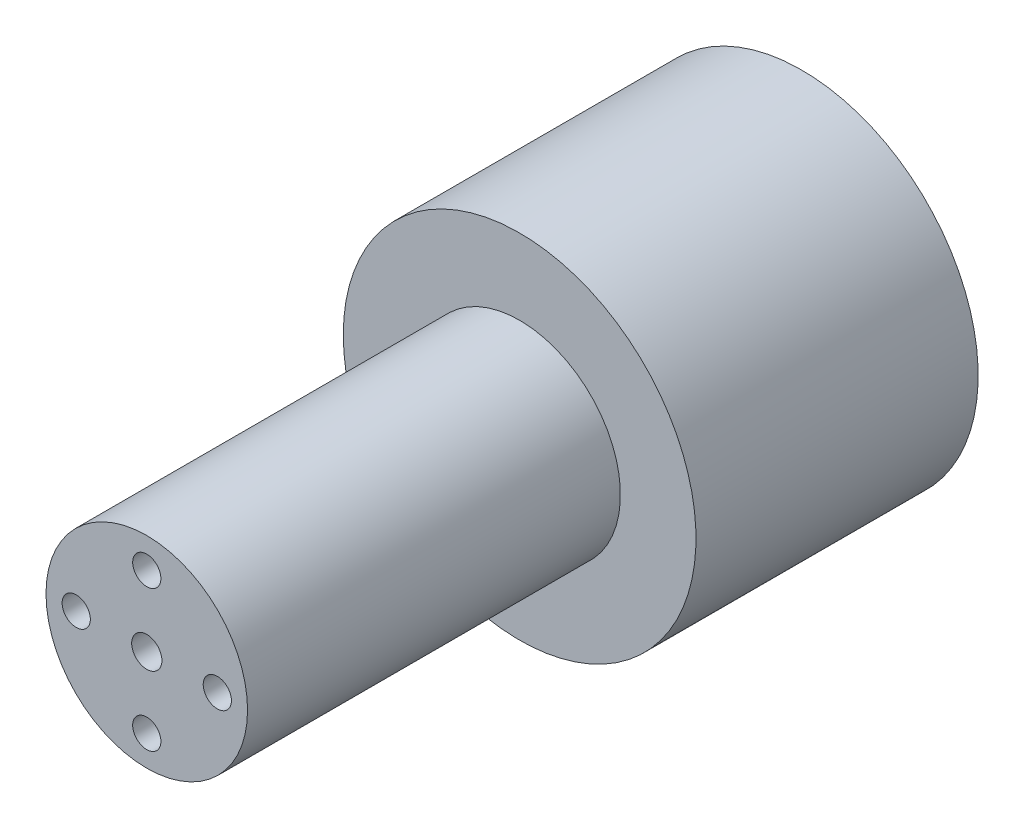
from build123d import *

# Parameters (mm, degrees)
SKETCH_1_R          = 10
EXTRUDE_1_DEPTH     = 65
CUT_EXTRUDE_1_DEPTH = 2.5
SKETCH_3_R          = 17.5
EXTRUDE_2_DEPTH     = 28
SKETCH_4_R          = 1.4
CUT_EXTRUDE_2_DEPTH = 3
SKETCH_5_R          = 1.5
CUT_EXTRUDE_3_DEPTH = 3


with BuildPart() as part:
    # 草图1 → 凸台-拉伸1 (new body)
    with BuildSketch(Plane.XY):
        Circle(SKETCH_1_R)
    extrude(amount=EXTRUDE_1_DEPTH)

    # 草图2 → 切除-拉伸1 (cut)
    with BuildSketch(Plane.ZY.offset(10)):
        with BuildLine():
            Line((30.6, 2.55), (37.6, 2.55))
            ThreePointArc((37.6, 2.55), (40.15, 0), (37.6, -2.55))
            Line((37.6, -2.55), (30.6, -2.55))
            ThreePointArc((30.6, -2.55), (28.05, 0), (30.6, 2.55))
        make_face()
    extrude(amount=-CUT_EXTRUDE_1_DEPTH, mode=Mode.SUBTRACT)

    # 草图3 → 凸台-拉伸2 (add)
    with BuildSketch(Plane(origin=(0, 0, 0), x_dir=(-1, 0, 0), z_dir=(0, 0, -1))):
        Circle(SKETCH_3_R)
    extrude(amount=-EXTRUDE_2_DEPTH)

    # 草图4 → 切除-拉伸2 (cut)
    with BuildSketch(Plane.XY.offset(65)):
        with Locations((0, 7)):
            Circle(SKETCH_4_R)
        with Locations((7, 0)):
            Circle(SKETCH_4_R)
        with Locations((0, -7)):
            Circle(SKETCH_4_R)
        with Locations((-7, 0)):
            Circle(SKETCH_4_R)
    extrude(amount=-CUT_EXTRUDE_2_DEPTH, mode=Mode.SUBTRACT)

    # 草图5 → 切除-拉伸3 (cut)
    with BuildSketch(Plane.XY.offset(65)):
        Circle(SKETCH_5_R)
    extrude(amount=-CUT_EXTRUDE_3_DEPTH, mode=Mode.SUBTRACT)


solid = part.part
